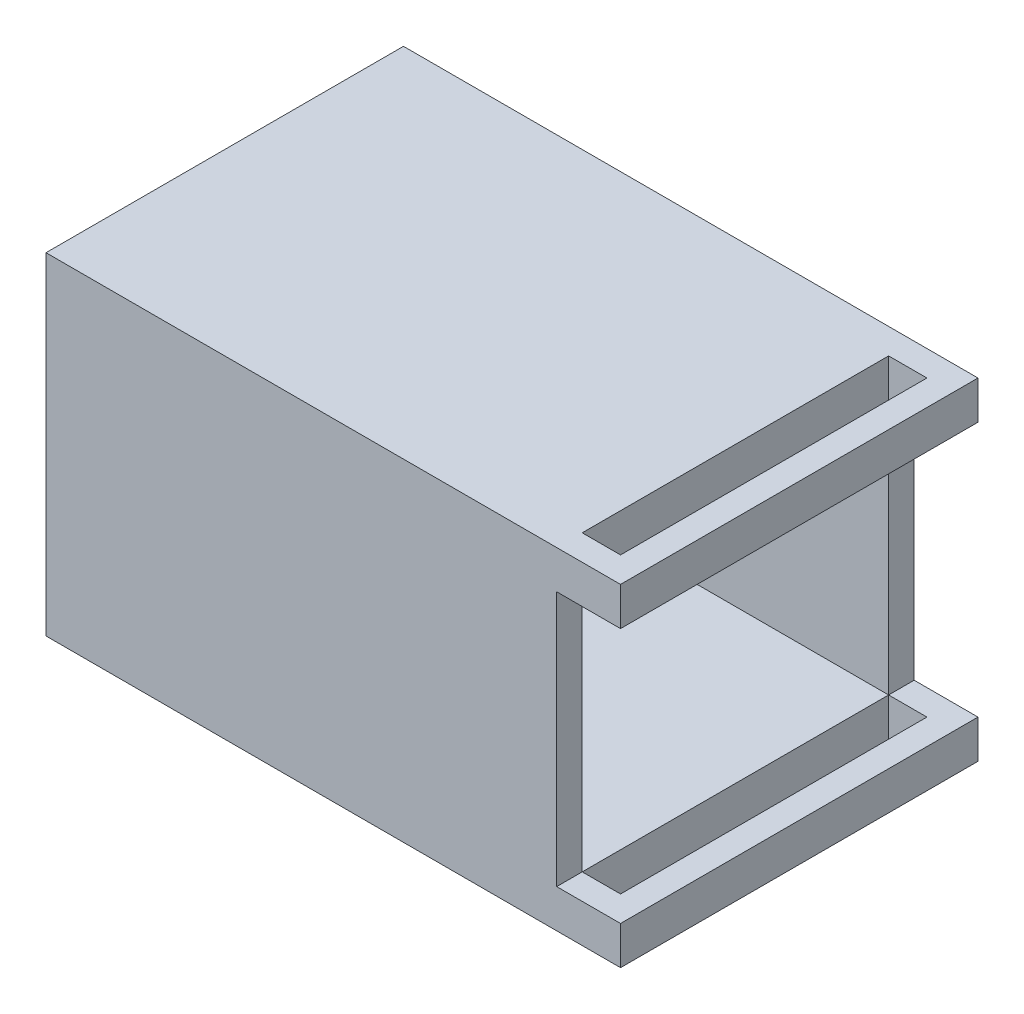
from build123d import *

# Parameters (mm, degrees)
SKETCH1_W           = 45
SKETCH1_H           = 28
BOSS_EXTRUDE1_DEPTH = 3
BOSS_EXTRUDE2_DEPTH = 22
SKETCH4_W           = 45
SKETCH4_H           = 28
SKETCH4_W_2         = 3
SKETCH4_H_2         = 24
BOSS_EXTRUDE4_DEPTH = 2
SKETCH5_W           = 9
SKETCH5_H           = 4
CUT_EXTRUDE1_DEPTH  = 2
SKETCH6_W           = 3
SKETCH6_H           = 24
CUT_EXTRUDE2_DEPTH  = 3
SKETCH7_W           = 45
SKETCH7_H           = 28
SKETCH7_W_2         = 3
SKETCH7_H_2         = 24
BOSS_EXTRUDE5_DEPTH = 1


with BuildPart() as part:
    # Sketch1 → Boss-Extrude1 (new body)
    with BuildSketch(Plane(origin=(0, 0, 0), x_dir=(1, 0, 0), z_dir=(0, 1, 0))):
        with Locations((22.5, 14)):
            Rectangle(SKETCH1_W, SKETCH1_H)
    extrude(amount=BOSS_EXTRUDE1_DEPTH)

    # Sketch2 → Boss-Extrude2 (add)
    with BuildSketch(Plane(origin=(0, 3, 0), x_dir=(1, 0, 0), z_dir=(0, 1, 0))):
        Polygon((40, 26), (40, 28), (0, 28), (0, 0), (40, 0), (40, 2), (2, 2), (2, 26), align=None)
    extrude(amount=BOSS_EXTRUDE2_DEPTH)

    # Sketch4 → Boss-Extrude4 (add)
    with BuildSketch(Plane(origin=(0, 25, 0), x_dir=(1, 0, 0), z_dir=(0, 1, 0))):
        with Locations((22.5, 14)):
            Rectangle(SKETCH4_W, SKETCH4_H)
        with Locations((41.5, 14)):
            Rectangle(SKETCH4_W_2, SKETCH4_H_2, mode=Mode.SUBTRACT)
    extrude(amount=-BOSS_EXTRUDE4_DEPTH)

    # Sketch5 → Cut-Extrude1 (cut)
    with BuildSketch(Plane.ZY):
        with BuildLine():
            Line((-18.72, 5.25), (-18.72, 5.96))
            ThreePointArc((-18.72, 5.96), (-18.353883476, 6.843883476), (-17.47, 7.21))
            Line((-17.47, 7.21), (-10.53, 7.21))
            ThreePointArc((-10.53, 7.21), (-9.646116524, 6.843883476), (-9.28, 5.96))
            Line((-9.28, 5.96), (-9.28, 5.25))
            ThreePointArc((-9.28, 5.25), (-9.646116524, 4.366116524), (-10.53, 4))
            Line((-10.53, 4), (-17.47, 4))
            ThreePointArc((-17.47, 4), (-18.353883476, 4.366116524), (-18.72, 5.25))
        make_face()
        with Locations((-14, 10.5)):
            Rectangle(SKETCH5_W, SKETCH5_H)
    extrude(amount=-CUT_EXTRUDE1_DEPTH, mode=Mode.SUBTRACT)

    # Sketch6 → Cut-Extrude2 (cut)
    with BuildSketch(Plane(origin=(0, 3, 0), x_dir=(1, 0, 0), z_dir=(0, 1, 0))):
        with Locations((41.5, 14)):
            Rectangle(SKETCH6_W, SKETCH6_H)
    extrude(amount=-CUT_EXTRUDE2_DEPTH, mode=Mode.SUBTRACT)

    # Sketch7 → Boss-Extrude5 (add)
    with BuildSketch(Plane(origin=(0, 25, 0), x_dir=(1, 0, 0), z_dir=(0, 1, 0))):
        with Locations((22.5, 14)):
            Rectangle(SKETCH7_W, SKETCH7_H)
        with Locations((41.5, 14)):
            Rectangle(SKETCH7_W_2, SKETCH7_H_2, mode=Mode.SUBTRACT)
    extrude(amount=BOSS_EXTRUDE5_DEPTH)


solid = part.part
